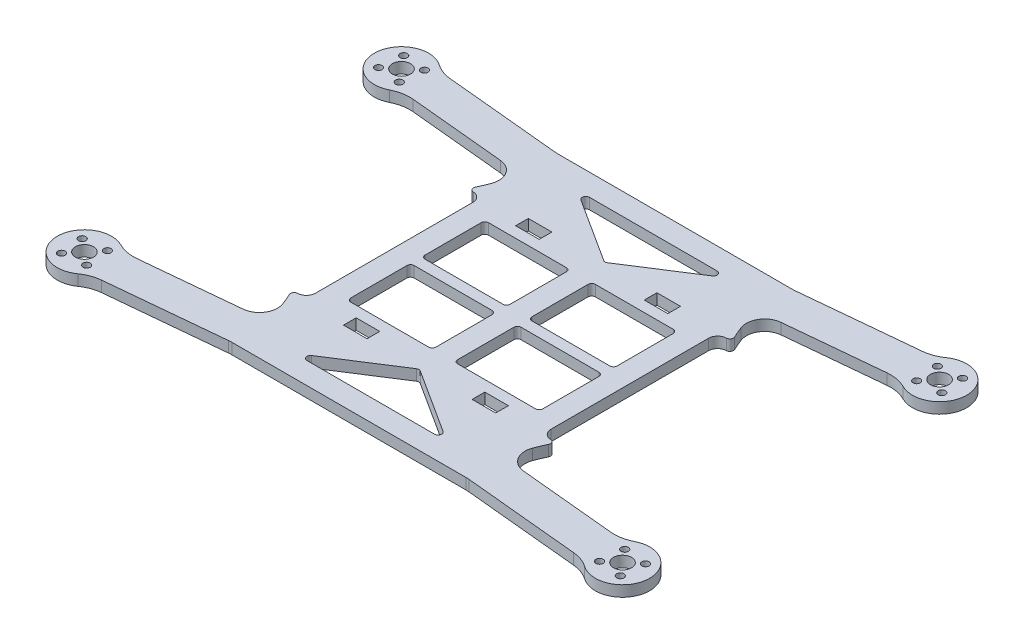
from build123d import *

# Parameters (mm, degrees)
SKETCH1_R           = 2.5
SKETCH1_R_2         = 1
SKETCH1_W           = 6.5
SKETCH1_H           = 3.5
BOSS_EXTRUDE1_DEPTH = 3


with BuildPart() as part:
    # Sketch1 → Boss-Extrude1 (new body)
    with BuildSketch(Plane(origin=(0, 0, 0), x_dir=(1, 0, 0), z_dir=(0, 1, 0))):
        with BuildLine():
            Line((-32.25, 45), (32.25, 45))
            ThreePointArc((32.25, 45), (32.729781285, 45.011516135), (33.208457525, 45.046038016))
            Line((33.208457525, 45.046038016), (65.158413836, 48.122468899))
            ThreePointArc((65.158413836, 48.122468899), (67.665203844, 48.696022601), (69.942838419, 49.88989895))
            ThreePointArc((69.942838419, 49.88989895), (81.731024928, 44.283166046), (70.857119505, 37.061325846))
            ThreePointArc((70.857119505, 37.061325846), (68.189665999, 37.969274319), (65.374821319, 38.097055623))
            Line((65.374821319, 38.097055623), (38.671218724, 35.525791146))
            ThreePointArc((38.671218724, 35.525791146), (34.907627779, 33.194274373), (34.470507151, 28.788651508))
            ThreePointArc((34.470507151, 28.788651508), (35.099285854, 27.2130238), (35.790444846, 25.663745072))
            ThreePointArc((35.790444846, 25.663745072), (35.738430228, 24.716138108), (34.918224383, 24.238721256))
            ThreePointArc((34.918224383, 24.238721256), (33.203553641, 23.478673593), (32.5, 21.740059064))
            Line((32.5, 21.740059064), (32.5, -21.740059064))
            ThreePointArc((32.5, -21.740059064), (33.203553641, -23.478673593), (34.918224383, -24.238721256))
            ThreePointArc((34.918224383, -24.238721256), (35.738430228, -24.716138108), (35.790444846, -25.663745072))
            ThreePointArc((35.790444846, -25.663745072), (35.099285854, -27.2130238), (34.470507151, -28.788651508))
            ThreePointArc((34.470507151, -28.788651508), (34.907627779, -33.194274373), (38.671218724, -35.525791146))
            Line((38.671218724, -35.525791146), (65.374821319, -38.097055623))
            ThreePointArc((65.374821319, -38.097055623), (68.189665999, -37.969274319), (70.857119505, -37.061325846))
            ThreePointArc((70.857119505, -37.061325846), (81.731024928, -44.283166046), (69.942838419, -49.88989895))
            ThreePointArc((69.942838419, -49.88989895), (67.665203844, -48.696022601), (65.158413836, -48.122468899))
            Line((65.158413836, -48.122468899), (33.208457525, -45.046038016))
            ThreePointArc((33.208457525, -45.046038016), (32.729781285, -45.011516135), (32.25, -45))
            Line((32.25, -45), (-32.25, -45))
            ThreePointArc((-32.25, -45), (-32.729781285, -45.011516135), (-33.208457525, -45.046038016))
            Line((-33.208457525, -45.046038016), (-65.158413836, -48.122468899))
            ThreePointArc((-65.158413836, -48.122468899), (-67.665203844, -48.696022601), (-69.942838419, -49.88989895))
            ThreePointArc((-69.942838419, -49.88989895), (-81.731024928, -44.283166046), (-70.857119505, -37.061325846))
            ThreePointArc((-70.857119505, -37.061325846), (-68.189665999, -37.969274319), (-65.374821319, -38.097055623))
            Line((-65.374821319, -38.097055623), (-38.671218724, -35.525791146))
            ThreePointArc((-38.671218724, -35.525791146), (-34.907627779, -33.194274373), (-34.470507151, -28.788651508))
            ThreePointArc((-34.470507151, -28.788651508), (-35.099285854, -27.2130238), (-35.790444846, -25.663745072))
            ThreePointArc((-35.790444846, -25.663745072), (-35.738430228, -24.716138108), (-34.918224383, -24.238721256))
            ThreePointArc((-34.918224383, -24.238721256), (-33.203553641, -23.478673593), (-32.5, -21.740059064))
            Line((-32.5, -21.740059064), (-32.5, 21.740059064))
            ThreePointArc((-32.5, 21.740059064), (-33.203553641, 23.478673593), (-34.918224383, 24.238721256))
            ThreePointArc((-34.918224383, 24.238721256), (-35.738430228, 24.716138108), (-35.790444846, 25.663745072))
            ThreePointArc((-35.790444846, 25.663745072), (-35.099285854, 27.2130238), (-34.470507151, 28.788651508))
            ThreePointArc((-34.470507151, 28.788651508), (-34.907627779, 33.194274373), (-38.671218724, 35.525791146))
            Line((-38.671218724, 35.525791146), (-65.374821319, 38.097055623))
            ThreePointArc((-65.374821319, 38.097055623), (-68.189665999, 37.969274319), (-70.857119505, 37.061325846))
            ThreePointArc((-70.857119505, 37.061325846), (-81.731024928, 44.283166046), (-69.942838419, 49.88989895))
            ThreePointArc((-69.942838419, 49.88989895), (-67.665203844, 48.696022601), (-65.158413836, 48.122468899))
            Line((-65.158413836, 48.122468899), (-33.208457525, 45.046038016))
            ThreePointArc((-33.208457525, 45.046038016), (-32.729781285, 45.011516135), (-32.25, 45))
        make_face()
        with Locations(Location((74.25, 43.75, 0), (0, 0, 270))):
            Circle(SKETCH1_R, mode=Mode.SUBTRACT)
        with Locations(Location((70.777689375, 46.612351991, 0), (0, 0, 270))):
            Circle(SKETCH1_R_2, mode=Mode.SUBTRACT)
        with Locations(Location((77.112351991, 47.222310625, 0), (0, 0, 270))):
            Circle(SKETCH1_R_2, mode=Mode.SUBTRACT)
        with Locations(Location((77.722310625, 40.887648009, 0), (0, 0, 270))):
            Circle(SKETCH1_R_2, mode=Mode.SUBTRACT)
        with Locations(Location((71.387648009, 40.277689375, 0), (0, 0, 270))):
            Circle(SKETCH1_R_2, mode=Mode.SUBTRACT)
        with Locations(Location((-71.387648009, 40.277689375, 0), (0, 0, 90))):
            Circle(SKETCH1_R_2, mode=Mode.SUBTRACT)
        with Locations(Location((-77.722310625, 40.887648009, 0), (0, 0, 90))):
            Circle(SKETCH1_R_2, mode=Mode.SUBTRACT)
        with Locations(Location((-77.112351991, 47.222310625, 0), (0, 0, 90))):
            Circle(SKETCH1_R_2, mode=Mode.SUBTRACT)
        with Locations(Location((-70.777689375, 46.612351991, 0), (0, 0, 90))):
            Circle(SKETCH1_R_2, mode=Mode.SUBTRACT)
        with Locations(Location((-74.25, 43.75, 0), (0, 0, 90))):
            Circle(SKETCH1_R, mode=Mode.SUBTRACT)
        with Locations(Location((-74.25, -43.75, 0), (0, 0, 270))):
            Circle(SKETCH1_R, mode=Mode.SUBTRACT)
        with Locations(Location((-70.777689375, -46.612351991, 0), (0, 0, 270))):
            Circle(SKETCH1_R_2, mode=Mode.SUBTRACT)
        with Locations(Location((-77.112351991, -47.222310625, 0), (0, 0, 270))):
            Circle(SKETCH1_R_2, mode=Mode.SUBTRACT)
        with Locations(Location((-77.722310625, -40.887648009, 0), (0, 0, 270))):
            Circle(SKETCH1_R_2, mode=Mode.SUBTRACT)
        with Locations(Location((-71.387648009, -40.277689375, 0), (0, 0, 270))):
            Circle(SKETCH1_R_2, mode=Mode.SUBTRACT)
        with Locations(Location((71.387648009, -40.277689375, 0), (0, 0, 90))):
            Circle(SKETCH1_R_2, mode=Mode.SUBTRACT)
        with Locations(Location((77.722310625, -40.887648009, 0), (0, 0, 90))):
            Circle(SKETCH1_R_2, mode=Mode.SUBTRACT)
        with Locations(Location((77.112351991, -47.222310625, 0), (0, 0, 90))):
            Circle(SKETCH1_R_2, mode=Mode.SUBTRACT)
        with Locations(Location((70.777689375, -46.612351991, 0), (0, 0, 90))):
            Circle(SKETCH1_R_2, mode=Mode.SUBTRACT)
        with Locations(Location((74.25, -43.75, 0), (0, 0, 90))):
            Circle(SKETCH1_R, mode=Mode.SUBTRACT)
        with BuildLine():
            Line((-17.6, 39), (17.6, 39))
            ThreePointArc((17.6, 39), (18.559559999, 38.28150419), (18.14024032, 37.158489218))
            Line((18.14024032, 37.158489218), (0.54024032, 25.859490032))
            ThreePointArc((0.54024032, 25.859490032), (0, 25.701000814), (-0.54024032, 25.859490032))
            Line((-0.54024032, 25.859490032), (-18.14024032, 37.158489218))
            ThreePointArc((-18.14024032, 37.158489218), (-18.559559999, 38.28150419), (-17.6, 39))
        make_face(mode=Mode.SUBTRACT)
        with BuildLine():
            Line((4, 1.5), (25.5, 1.5))
            ThreePointArc((25.5, 1.5), (26.207106781, 1.792893219), (26.5, 2.5))
            Line((26.5, 2.5), (26.5, 18))
            ThreePointArc((26.5, 18), (26.207106781, 18.707106781), (25.5, 19))
            Line((25.5, 19), (4, 19))
            ThreePointArc((4, 19), (3.292893219, 18.707106781), (3, 18))
            Line((3, 18), (3, 2.5))
            ThreePointArc((3, 2.5), (3.292893219, 1.792893219), (4, 1.5))
        make_face(mode=Mode.SUBTRACT)
        with Locations((17.75, 23.75)):
            Rectangle(SKETCH1_W, SKETCH1_H, mode=Mode.SUBTRACT)
        with Locations((-17.75, 23.75)):
            Rectangle(SKETCH1_W, SKETCH1_H, mode=Mode.SUBTRACT)
        with BuildLine():
            Line((-26.5, 2.5), (-26.5, 18))
            ThreePointArc((-26.5, 18), (-26.207106781, 18.707106781), (-25.5, 19))
            Line((-25.5, 19), (-4, 19))
            ThreePointArc((-4, 19), (-3.292893219, 18.707106781), (-3, 18))
            Line((-3, 18), (-3, 2.5))
            ThreePointArc((-3, 2.5), (-3.292893219, 1.792893219), (-4, 1.5))
            Line((-4, 1.5), (-25.5, 1.5))
            ThreePointArc((-25.5, 1.5), (-26.207106781, 1.792893219), (-26.5, 2.5))
        make_face(mode=Mode.SUBTRACT)
        with BuildLine():
            Line((-4, -1.5), (-25.5, -1.5))
            ThreePointArc((-25.5, -1.5), (-26.207106781, -1.792893219), (-26.5, -2.5))
            Line((-26.5, -2.5), (-26.5, -18))
            ThreePointArc((-26.5, -18), (-26.207106781, -18.707106781), (-25.5, -19))
            Line((-25.5, -19), (-4, -19))
            ThreePointArc((-4, -19), (-3.292893219, -18.707106781), (-3, -18))
            Line((-3, -18), (-3, -2.5))
            ThreePointArc((-3, -2.5), (-3.292893219, -1.792893219), (-4, -1.5))
        make_face(mode=Mode.SUBTRACT)
        with Locations((-17.75, -23.75)):
            Rectangle(SKETCH1_W, SKETCH1_H, mode=Mode.SUBTRACT)
        with BuildLine():
            Line((-18.14024032, -37.158489218), (-0.54024032, -25.859490032))
            ThreePointArc((-0.54024032, -25.859490032), (0, -25.701000814), (0.54024032, -25.859490032))
            Line((0.54024032, -25.859490032), (18.14024032, -37.158489218))
            ThreePointArc((18.14024032, -37.158489218), (18.559559999, -38.28150419), (17.6, -39))
            Line((17.6, -39), (-17.6, -39))
            ThreePointArc((-17.6, -39), (-18.559559999, -38.28150419), (-18.14024032, -37.158489218))
        make_face(mode=Mode.SUBTRACT)
        with Locations((17.75, -23.75)):
            Rectangle(SKETCH1_W, SKETCH1_H, mode=Mode.SUBTRACT)
        with BuildLine():
            Line((26.5, -2.5), (26.5, -18))
            ThreePointArc((26.5, -18), (26.207106781, -18.707106781), (25.5, -19))
            Line((25.5, -19), (4, -19))
            ThreePointArc((4, -19), (3.292893219, -18.707106781), (3, -18))
            Line((3, -18), (3, -2.5))
            ThreePointArc((3, -2.5), (3.292893219, -1.792893219), (4, -1.5))
            Line((4, -1.5), (25.5, -1.5))
            ThreePointArc((25.5, -1.5), (26.207106781, -1.792893219), (26.5, -2.5))
        make_face(mode=Mode.SUBTRACT)
    extrude(amount=BOSS_EXTRUDE1_DEPTH)


solid = part.part
